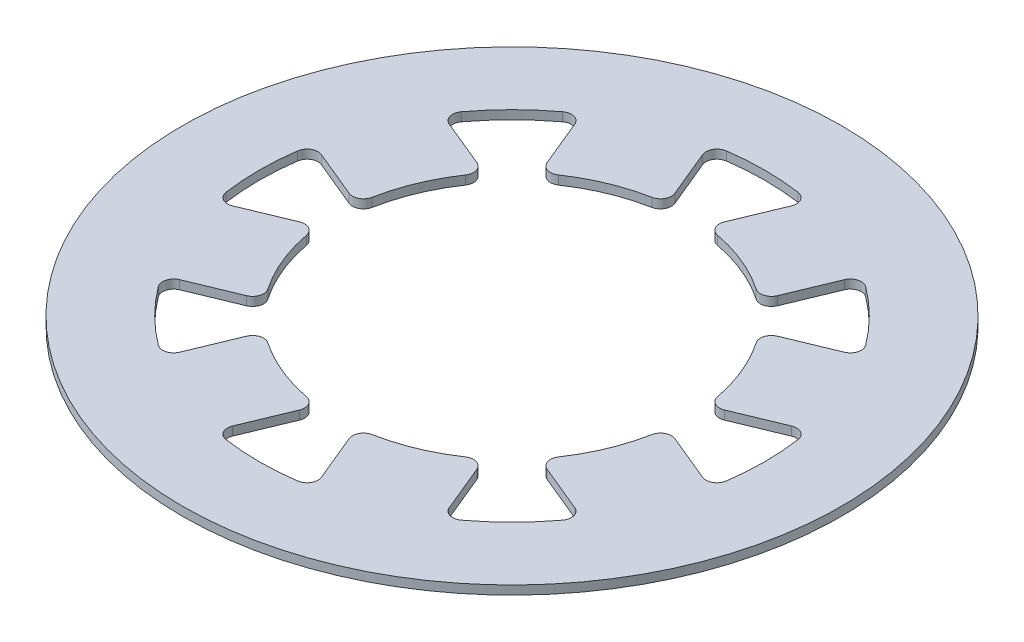
from build123d import *

# Parameters (mm, degrees)
SKETCH1_R           = 7.5
BOSS_EXTRUDE1_DEPTH = 0.2


with BuildPart() as part:
    # Sketch1 → Boss-Extrude1 (new body)
    with BuildSketch(Plane(origin=(0, 0, 0), x_dir=(1, 0, 0), z_dir=(0, 1, 0))):
        with Locations(Location((0, 0, 0), (0, 0, 270))):
            Circle(SKETCH1_R)
        with BuildLine():
            Line((4.270625279, -0.564175126), (5.348769596, -1.010757124))
            ThreePointArc((5.348769596, -1.010757124), (5.568208781, -0.997000043), (5.69191502, -0.815232116))
            ThreePointArc((5.69191502, -0.815232116), (5.735460372, -0.408649381), (5.75, 0))
            ThreePointArc((5.75, 0), (5.735460372, 0.408649381), (5.69191502, 0.815232116))
            ThreePointArc((5.69191502, 0.815232116), (5.568208781, 0.997000043), (5.348769596, 1.010757124))
            Line((5.348769596, 1.010757124), (4.270625279, 0.564175126))
            ThreePointArc((4.270625279, 0.564175126), (4.05620803, 0.575146612), (3.929368867, 0.748371773))
            ThreePointArc((3.929368867, 0.748371773), (3.832459783, 1.145535689), (3.69551813, 1.530733729))
            ThreePointArc((3.69551813, 1.530733729), (3.519974355, 1.899942247), (3.307662127, 2.249304616))
            ThreePointArc((3.307662127, 2.249304616), (3.274862273, 2.461482135), (3.418720152, 2.620856037))
            Line((3.418720152, 2.620856037), (4.496864469, 3.067438036))
            ThreePointArc((4.496864469, 3.067438036), (4.642303679, 3.232332697), (4.601247866, 3.448335552))
            ThreePointArc((4.601247866, 3.448335552), (4.344541671, 3.766624174), (4.065863992, 4.065863992))
            ThreePointArc((4.065863992, 4.065863992), (3.766624174, 4.344541671), (3.448335552, 4.601247866))
            ThreePointArc((3.448335552, 4.601247866), (3.232332697, 4.642303679), (3.067438036, 4.496864469))
            Line((3.067438036, 4.496864469), (2.620856037, 3.418720152))
            ThreePointArc((2.620856037, 3.418720152), (2.461482135, 3.274862273), (2.249304616, 3.307662127))
            ThreePointArc((2.249304616, 3.307662127), (1.899942247, 3.519974355), (1.530733729, 3.69551813))
            ThreePointArc((1.530733729, 3.69551813), (1.145535689, 3.832459783), (0.748371773, 3.929368867))
            ThreePointArc((0.748371773, 3.929368867), (0.575146612, 4.05620803), (0.564175126, 4.270625279))
            Line((0.564175126, 4.270625279), (1.010757124, 5.348769596))
            ThreePointArc((1.010757124, 5.348769596), (0.997000043, 5.568208781), (0.815232116, 5.69191502))
            ThreePointArc((0.815232116, 5.69191502), (0.408649381, 5.735460372), (0, 5.75))
            ThreePointArc((0, 5.75), (-0.408649381, 5.735460372), (-0.815232116, 5.69191502))
            ThreePointArc((-0.815232116, 5.69191502), (-0.997000043, 5.568208781), (-1.010757124, 5.348769596))
            Line((-1.010757124, 5.348769596), (-0.564175126, 4.270625279))
            ThreePointArc((-0.564175126, 4.270625279), (-0.575146612, 4.05620803), (-0.748371773, 3.929368867))
            ThreePointArc((-0.748371773, 3.929368867), (-1.145535689, 3.832459783), (-1.530733729, 3.69551813))
            ThreePointArc((-1.530733729, 3.69551813), (-1.899942247, 3.519974355), (-2.249304616, 3.307662127))
            ThreePointArc((-2.249304616, 3.307662127), (-2.461482135, 3.274862273), (-2.620856037, 3.418720152))
            Line((-2.620856037, 3.418720152), (-3.067438036, 4.496864469))
            ThreePointArc((-3.067438036, 4.496864469), (-3.232332697, 4.642303679), (-3.448335552, 4.601247866))
            ThreePointArc((-3.448335552, 4.601247866), (-3.766624174, 4.344541671), (-4.065863992, 4.065863992))
            ThreePointArc((-4.065863992, 4.065863992), (-4.344541671, 3.766624174), (-4.601247866, 3.448335552))
            ThreePointArc((-4.601247866, 3.448335552), (-4.642303679, 3.232332697), (-4.496864469, 3.067438036))
            Line((-4.496864469, 3.067438036), (-3.418720152, 2.620856037))
            ThreePointArc((-3.418720152, 2.620856037), (-3.274862273, 2.461482135), (-3.307662127, 2.249304616))
            ThreePointArc((-3.307662127, 2.249304616), (-3.519974355, 1.899942247), (-3.69551813, 1.530733729))
            ThreePointArc((-3.69551813, 1.530733729), (-3.832459783, 1.145535689), (-3.929368867, 0.748371773))
            ThreePointArc((-3.929368867, 0.748371773), (-4.05620803, 0.575146612), (-4.270625279, 0.564175126))
            Line((-4.270625279, 0.564175126), (-5.348769596, 1.010757124))
            ThreePointArc((-5.348769596, 1.010757124), (-5.568208781, 0.997000043), (-5.69191502, 0.815232116))
            ThreePointArc((-5.69191502, 0.815232116), (-5.735460372, 0.408649381), (-5.75, 0))
            ThreePointArc((-5.75, 0), (-5.735460372, -0.408649381), (-5.69191502, -0.815232116))
            ThreePointArc((-5.69191502, -0.815232116), (-5.568208781, -0.997000043), (-5.348769596, -1.010757124))
            Line((-5.348769596, -1.010757124), (-4.270625279, -0.564175126))
            ThreePointArc((-4.270625279, -0.564175126), (-4.05620803, -0.575146612), (-3.929368867, -0.748371773))
            ThreePointArc((-3.929368867, -0.748371773), (-3.832459783, -1.145535689), (-3.69551813, -1.530733729))
            ThreePointArc((-3.69551813, -1.530733729), (-3.519974355, -1.899942247), (-3.307662127, -2.249304616))
            ThreePointArc((-3.307662127, -2.249304616), (-3.274862273, -2.461482135), (-3.418720152, -2.620856037))
            Line((-3.418720152, -2.620856037), (-4.496864469, -3.067438036))
            ThreePointArc((-4.496864469, -3.067438036), (-4.642303679, -3.232332697), (-4.601247866, -3.448335552))
            ThreePointArc((-4.601247866, -3.448335552), (-4.344541671, -3.766624174), (-4.065863992, -4.065863992))
            ThreePointArc((-4.065863992, -4.065863992), (-3.766624174, -4.344541671), (-3.448335552, -4.601247866))
            ThreePointArc((-3.448335552, -4.601247866), (-3.232332697, -4.642303679), (-3.067438036, -4.496864469))
            Line((-3.067438036, -4.496864469), (-2.620856037, -3.418720152))
            ThreePointArc((-2.620856037, -3.418720152), (-2.461482135, -3.274862273), (-2.249304616, -3.307662127))
            ThreePointArc((-2.249304616, -3.307662127), (-1.899942247, -3.519974355), (-1.530733729, -3.69551813))
            ThreePointArc((-1.530733729, -3.69551813), (-1.145535689, -3.832459783), (-0.748371773, -3.929368867))
            ThreePointArc((-0.748371773, -3.929368867), (-0.575146612, -4.05620803), (-0.564175126, -4.270625279))
            Line((-0.564175126, -4.270625279), (-1.010757124, -5.348769596))
            ThreePointArc((-1.010757124, -5.348769596), (-0.997000043, -5.568208781), (-0.815232116, -5.69191502))
            ThreePointArc((-0.815232116, -5.69191502), (-0.408649381, -5.735460372), (0, -5.75))
            ThreePointArc((0, -5.75), (0.408649381, -5.735460372), (0.815232116, -5.69191502))
            ThreePointArc((0.815232116, -5.69191502), (0.997000043, -5.568208781), (1.010757124, -5.348769596))
            Line((1.010757124, -5.348769596), (0.564175126, -4.270625279))
            ThreePointArc((0.564175126, -4.270625279), (0.575146612, -4.05620803), (0.748371773, -3.929368867))
            ThreePointArc((0.748371773, -3.929368867), (1.145535689, -3.832459783), (1.530733729, -3.69551813))
            ThreePointArc((1.530733729, -3.69551813), (1.899942247, -3.519974355), (2.249304616, -3.307662127))
            ThreePointArc((2.249304616, -3.307662127), (2.461482135, -3.274862273), (2.620856037, -3.418720152))
            Line((2.620856037, -3.418720152), (3.067438036, -4.496864469))
            ThreePointArc((3.067438036, -4.496864469), (3.232332697, -4.642303679), (3.448335552, -4.601247866))
            ThreePointArc((3.448335552, -4.601247866), (3.766624174, -4.344541671), (4.065863992, -4.065863992))
            ThreePointArc((4.065863992, -4.065863992), (4.344541671, -3.766624174), (4.601247866, -3.448335552))
            ThreePointArc((4.601247866, -3.448335552), (4.642303679, -3.232332697), (4.496864469, -3.067438036))
            Line((4.496864469, -3.067438036), (3.418720152, -2.620856037))
            ThreePointArc((3.418720152, -2.620856037), (3.274862273, -2.461482135), (3.307662127, -2.249304616))
            ThreePointArc((3.307662127, -2.249304616), (3.519974355, -1.899942247), (3.69551813, -1.530733729))
            ThreePointArc((3.69551813, -1.530733729), (3.832459783, -1.145535689), (3.929368867, -0.748371773))
            ThreePointArc((3.929368867, -0.748371773), (4.05620803, -0.575146612), (4.270625279, -0.564175126))
        make_face(mode=Mode.SUBTRACT)
    extrude(amount=BOSS_EXTRUDE1_DEPTH)


solid = part.part
